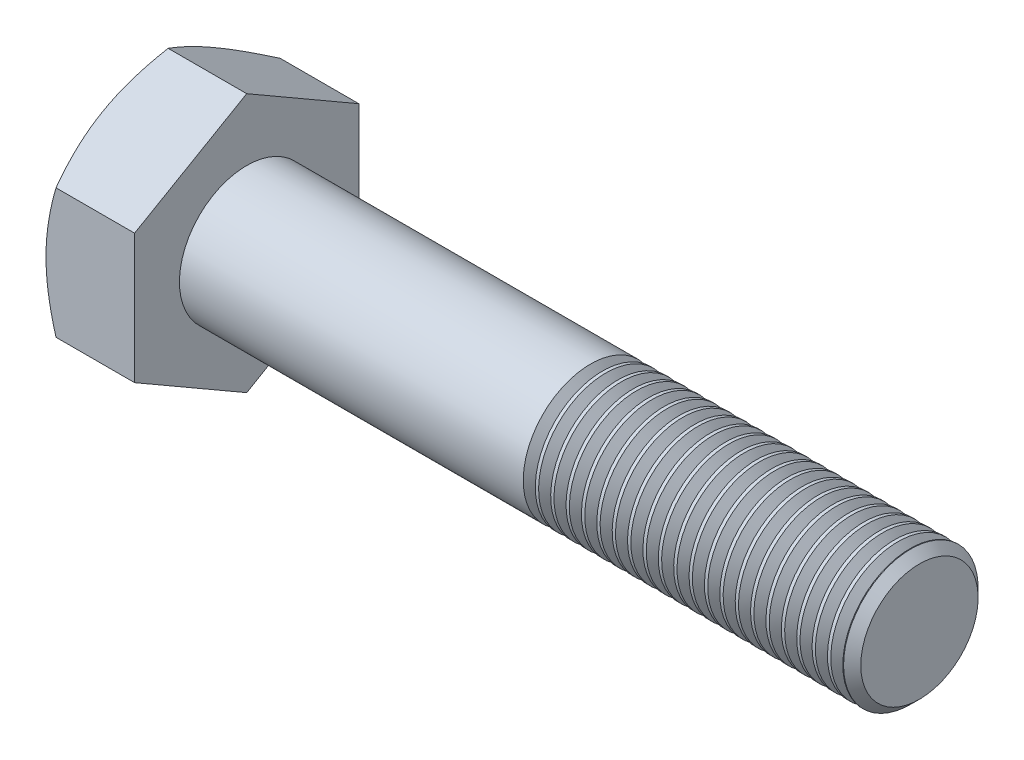
from build123d import *

# Parameters (mm, degrees)
BASEHEAD_DEPTH  = 19.75
THDSCHPAT_COUNT = 21
THDSCHPAT_PITCH = 3.428571429


with BuildPart() as part:
    # Sketch1 → BaseHead (new body)
    with BuildSketch(Plane(origin=(0, 0, 0), x_dir=(0, 0, -1), z_dir=(1, 0, 0))):
        Polygon((25, 14.43375673), (25, -14.43375673), (0, -28.867513459), (-25, -14.43375673), (-25, 14.43375673), (0, 28.867513459), align=None)
    extrude(amount=BASEHEAD_DEPTH)

    # BodySke → BaseBody (revolve)
    with BuildSketch(Plane.XY, mode=Mode.PRIVATE) as basebody_sk:
        Polygon((0, 0), (169.75, 0), (169.75, 13.079), (167.829, 15), (0, 15), align=None)
    revolve(basebody_sk.sketch.rotate(Axis((0, 0, 0), (1, 0, 0)), 90), axis=Axis((0, 0, 0), (1, 0, 0)))

    # Sketch3 → HeadChamfer (revolve, cut)
    with BuildSketch(Plane.XY):
        Polygon((0, 25), (5.119661283, 33.867513459), (5.119661283, 38.867513459), (-10, 38.867513459), (-10, 25), align=None)
    revolve(axis=Axis((0, 0, 0), (1, 0, 0)), mode=Mode.SUBTRACT)

    # ThdSchSke → ThreadSchematic (revolve, cut)
    with BuildSketch(Plane.XY):
        Polygon((97.75, -13.079), (96.404901319, -15), (96.404901319, -18.75), (99.095098681, -18.75), (99.095098681, -15), align=None)
    threadschematic = revolve(axis=Axis((-3.175, 0, 0), (1, 0, 0)), mode=Mode.SUBTRACT)

    # ThdSchPat: ThreadSchematic ×21
    with Locations(*[(i * THDSCHPAT_PITCH, 0, 0) for i in range(1, THDSCHPAT_COUNT)]):
        add(threadschematic, mode=Mode.SUBTRACT)


solid = part.part
